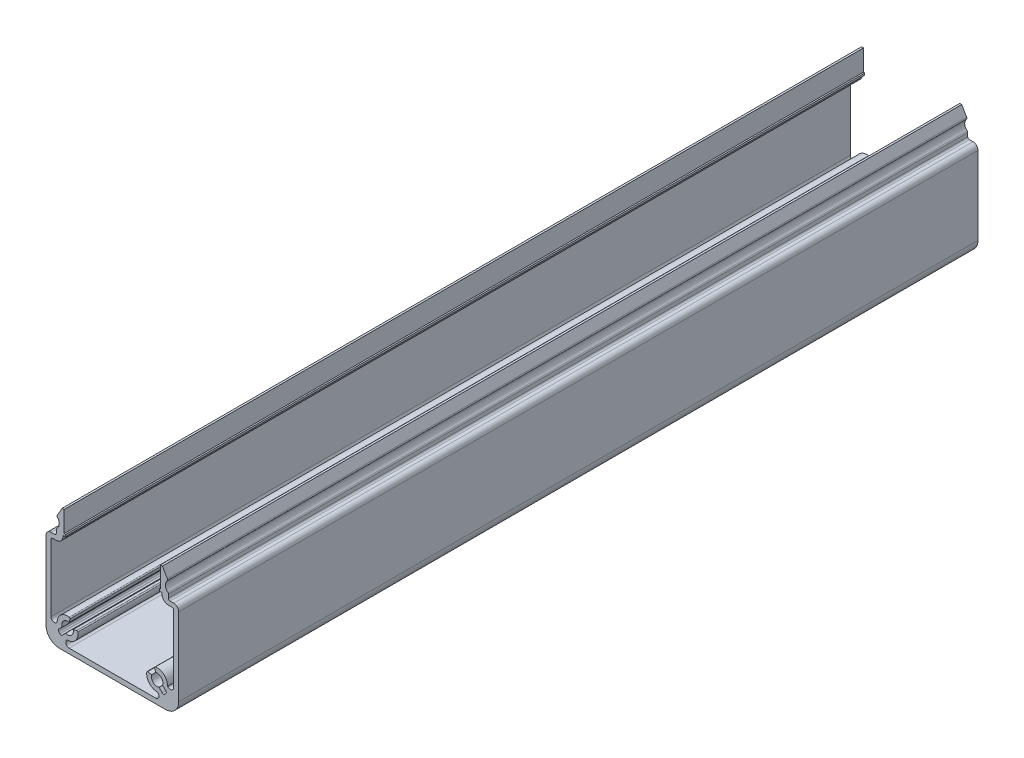
from build123d import *

# Parameters (mm, degrees)
BOSS_EXTRUDE1_DEPTH = 241


with BuildPart() as part:
    # Sketch1 → Boss-Extrude1 (new body)
    with BuildSketch(Plane.XY.offset(20)):
        with BuildLine():
            Line((4, 0), (36, 0))
            ThreePointArc((36, 0), (38.828427125, 1.171572875), (40, 4))
            Line((40, 4), (40, 27.499999994))
            ThreePointArc((40, 27.499999994), (39.56066017, 28.56066017), (38.499999994, 29))
            Line((38.499999994, 29), (37.408493132, 29))
            ThreePointArc((37.408493132, 29), (37.05493974, 29.14644661), (36.90849313, 29.500000002))
            Line((36.90849313, 29.500000002), (36.90849313, 30.572020267))
            ThreePointArc((36.90849313, 30.572020267), (36.86079319, 30.785150869), (36.726794508, 30.957616203))
            ThreePointArc((36.726794508, 30.957616203), (36.005111578, 32.357100716), (36.519951827, 33.845160752))
            ThreePointArc((36.519951827, 33.845160752), (36.647077826, 34.128030253), (36.582952488, 34.431450944))
            Line((36.582952488, 34.431450944), (35.099999998, 37.000000001))
            Line((35.099999998, 37.000000001), (34.500000002, 37.000000001))
            Line((34.500000002, 37.000000001), (34.500000002, 30.672689193))
            Line((34.500000002, 30.672689193), (34.158493132, 30.561067543))
            Line((34.158493132, 30.561067543), (34.158493132, 29.989862813))
            Line((34.158493132, 29.989862813), (34.908493132, 29.989862813))
            Line((34.908493132, 29.989862813), (34.908493132, 29.700000011))
            ThreePointArc((34.908493132, 29.700000011), (35.494279572, 28.285786443), (36.908493141, 27.700000003))
            Line((36.908493141, 27.700000003), (38.000000017, 27.700000003))
            ThreePointArc((38.000000017, 27.700000003), (38.353553409, 27.553553393), (38.500000019, 27.200000001))
            Line((38.500000019, 27.200000001), (38.500000019, 6.9547727))
            ThreePointArc((38.500000019, 6.9547727), (37.882683451, 6.030893167), (36.792893237, 6.247665919))
            Line((36.792893237, 6.247665919), (36.648161659, 6.392397496))
            ThreePointArc((36.648161659, 6.392397496), (35.587251229, 8.859212237), (33.009530056, 9.611581471))
            ThreePointArc((33.009530056, 9.611581471), (32.804700675, 9.478725012), (32.766463725, 9.237594653))
            Line((32.766463725, 9.237594653), (33.047066675, 8.190370192))
            ThreePointArc((33.047066675, 8.190370192), (34.786339421, 7.686520507), (35.148364083, 5.912296075))
            Line((35.148364083, 5.912296075), (36.146446608, 4.91421355))
            ThreePointArc((36.146446608, 4.91421355), (36.292893217, 4.560660161), (36.146446608, 4.207106773))
            Line((36.146446608, 4.207106773), (35.792893214, 3.853553379))
            ThreePointArc((35.792893214, 3.853553379), (35.439339826, 3.70710677), (35.085786437, 3.853553379))
            Line((35.085786437, 3.853553379), (34.087703906, 4.85163591))
            ThreePointArc((34.087703906, 4.85163591), (32.313479487, 5.213660585), (31.809629807, 6.952933321))
            Line((31.809629807, 6.952933321), (30.762405333, 7.233536272))
            ThreePointArc((30.762405333, 7.233536272), (30.521274984, 7.195299323), (30.38841853, 6.990469949))
            ThreePointArc((30.38841853, 6.990469949), (31.140787752, 4.412748784), (33.607602477, 3.351838341))
            Line((33.607602477, 3.351838341), (33.752334032, 3.207106785))
            ThreePointArc((33.752334032, 3.207106785), (33.969106782, 2.117316579), (33.045227255, 1.500000015))
            Line((33.045227255, 1.500000015), (6.954772716, 1.500000015))
            ThreePointArc((6.954772716, 1.500000015), (6.030893183, 2.117316583), (6.247665934, 3.207106797))
            Line((6.247665934, 3.207106797), (6.392397512, 3.351838375))
            ThreePointArc((6.392397512, 3.351838375), (8.859212224, 4.412748803), (9.611581449, 6.990469949))
            ThreePointArc((9.611581449, 6.990469949), (9.478724996, 7.195299323), (9.237594646, 7.233536272))
            Line((9.237594646, 7.233536272), (8.190370187, 6.952933328))
            ThreePointArc((8.190370187, 6.952933328), (7.686520502, 5.213660596), (5.912296085, 4.851635932))
            Line((5.912296085, 4.851635932), (4.914213553, 3.8535534))
            ThreePointArc((4.914213553, 3.8535534), (4.560660164, 3.707106791), (4.207106776, 3.8535534))
            Line((4.207106776, 3.8535534), (3.853553388, 4.207106787))
            ThreePointArc((3.853553388, 4.207106787), (3.70710678, 4.560660175), (3.853553388, 4.914213564))
            Line((3.853553388, 4.914213564), (4.85163592, 5.912296095))
            ThreePointArc((4.85163592, 5.912296095), (5.213660585, 7.686520517), (6.952933322, 8.190370198))
            Line((6.952933322, 8.190370198), (7.233536268, 9.237594644))
            ThreePointArc((7.233536268, 9.237594644), (7.195299318, 9.478725003), (6.990469936, 9.611581462))
            ThreePointArc((6.990469936, 9.611581462), (4.412748785, 8.859212233), (3.351838362, 6.392397513))
            Line((3.351838362, 6.392397513), (3.207106785, 6.247665935))
            ThreePointArc((3.207106785, 6.247665935), (2.11731657, 6.030893183), (1.500000002, 6.954772717))
            Line((1.500000002, 6.954772717), (1.500000002, 27.200000001))
            ThreePointArc((1.500000002, 27.200000001), (1.646446612, 27.553553393), (2.000000004, 27.700000003))
            Line((2.000000004, 27.700000003), (3.091506864, 27.700000003))
            ThreePointArc((3.091506864, 27.700000003), (4.505720432, 28.285786443), (5.091506872, 29.700000011))
            Line((5.091506872, 29.700000011), (5.091506872, 29.989862813))
            Line((5.091506872, 29.989862813), (5.841506868, 29.989862813))
            Line((5.841506868, 29.989862813), (5.841506868, 30.561067541))
            Line((5.841506868, 30.561067541), (5.499999998, 30.672689191))
            Line((5.499999998, 30.672689191), (5.499999998, 37.000000001))
            Line((5.499999998, 37.000000001), (4.899999998, 37.000000001))
            Line((4.899999998, 37.000000001), (3.417047508, 34.431450944))
            ThreePointArc((3.417047508, 34.431450944), (3.35292217, 34.128030253), (3.480048169, 33.845160751))
            ThreePointArc((3.480048169, 33.845160751), (3.99488842, 32.357100716), (3.273205491, 30.957616203))
            ThreePointArc((3.273205491, 30.957616203), (3.13920681, 30.785150869), (3.09150687, 30.572020267))
            Line((3.09150687, 30.572020267), (3.09150687, 29.500000002))
            ThreePointArc((3.09150687, 29.500000002), (2.94506026, 29.14644661), (2.591506868, 29))
            Line((2.591506868, 29), (1.500000006, 29))
            ThreePointArc((1.500000006, 29), (0.43933983, 28.56066017), (0, 27.499999994))
            Line((0, 27.499999994), (0, 4))
            ThreePointArc((0, 4), (1.171572875, 1.171572875), (4, 0))
        make_face()
    extrude(amount=-BOSS_EXTRUDE1_DEPTH)


solid = part.part
